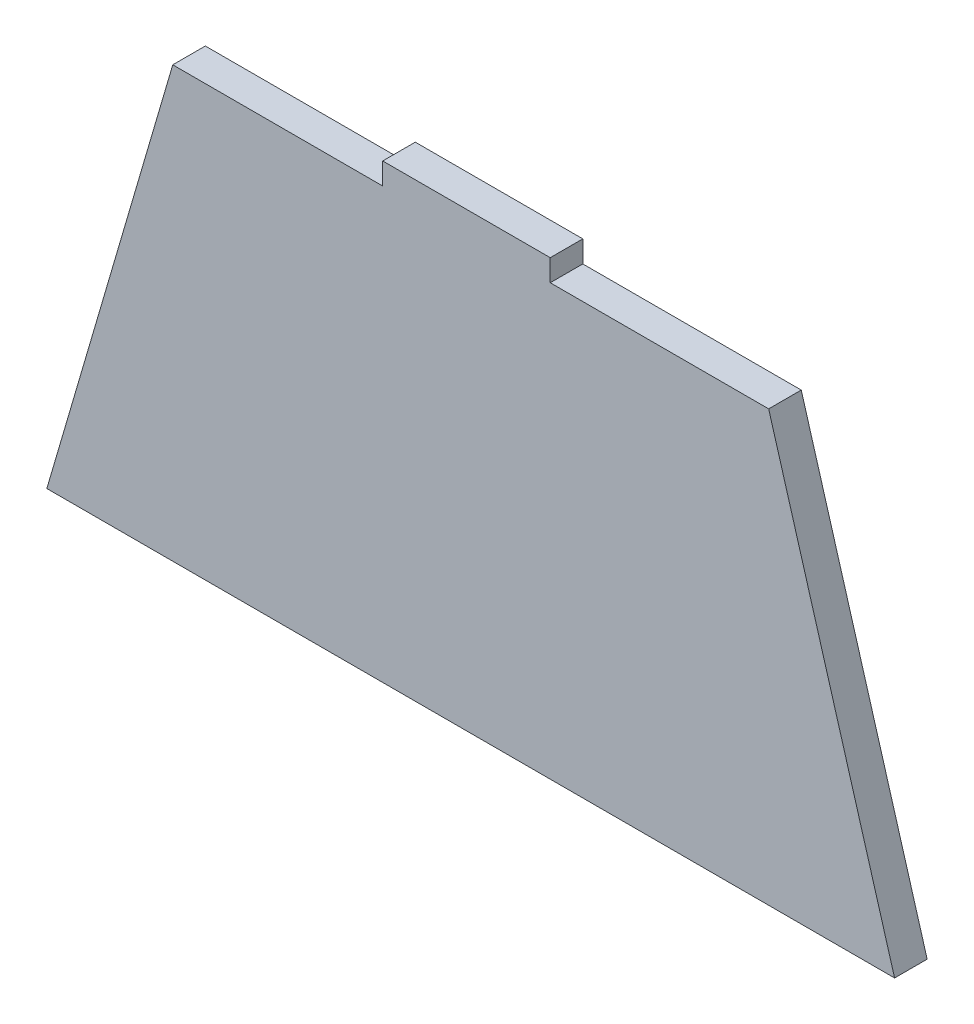
from build123d import *

# Parameters (mm, degrees)
BOSS_EXTRUDE1_DEPTH = 9.525


with BuildPart() as part:
    # Sketch1 → Boss-Extrude1 (new body)
    with BuildSketch(Plane.XY):
        Polygon((-211.493032125, 138.63279335), (-248.316682125, 12.91041335), (-0.412682125, 12.91041335), (-37.236332125, 138.63279335), (-101.111008696, 138.63279335), (-101.111008696, 144.98279335), (-150.099486916, 144.98279335), (-150.099486916, 138.63279335), align=None)
    extrude(amount=-BOSS_EXTRUDE1_DEPTH)


solid = part.part
